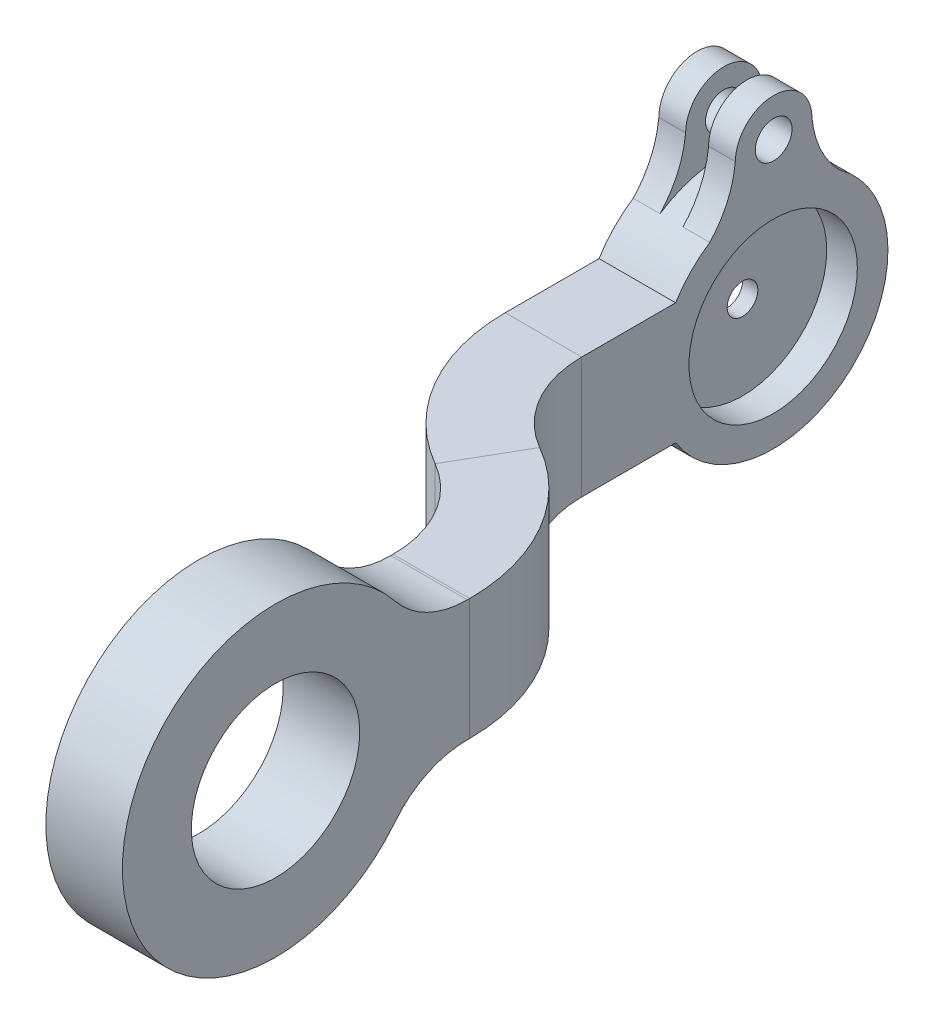
from build123d import *

# Parameters (mm, degrees)
CROQUIS2_W              = 10
CROQUIS2_H              = 15.834903248
CROQUIS4_R              = 15
SALIENTE_EXTRUIR1_DEPTH = 10
CROQUIS5_R              = 20
SALIENTE_EXTRUIR2_DEPTH = 10
SALIENTE_EXTRUIR5_DEPTH = 3.5
CROQUIS13_R             = 2.4
CORTAR_EXTRUIR1_DEPTH   = 10
CROQUIS7_R              = 11
CORTAR_EXTRUIR3_DEPTH   = 10
REDONDEO2_R             = 12
REDONDEO3_R             = 12
CROQUIS14_R             = 11
CORTAR_EXTRUIR4_DEPTH   = 4
CROQUIS6_R              = 2
CORTAR_EXTRUIR5_DEPTH   = 6
CORTAR_EXTRUIR6_START   = -4
CROQUIS15_R             = 11
CORTAR_EXTRUIR6_DEPTH   = 4


with BuildPart() as part:
    # Barrer1: sweep along a path in Croquis1
    with BuildLine(Plane(origin=(0, 0, 0), x_dir=(1, 0, 0), z_dir=(0, 1, 0))) as barrer1_path:
        Line((-20, 85), (-20, 60))
        ThreePointArc((-20, 60), (-17.320508076, 50), (-10, 42.679491924))
        ThreePointArc((-10, 42.679491924), (-2.679491924, 35.358983849), (0, 25.358983849))
        Line((0, 25.358983849), (0, 0))
    # Croquis2 → Barrer1 (sweep)
    with BuildSketch(Plane.XY):
        Rectangle(CROQUIS2_W, CROQUIS2_H)
    sweep(path=barrer1_path.line)

    # Croquis4 → Saliente-Extruir1 (add)
    with BuildSketch(Plane(origin=(-15, 0, 0), x_dir=(0, 0, -1), z_dir=(1, 0, 0))):
        with Locations((85, 0)):
            Circle(CROQUIS4_R)
    extrude(amount=-SALIENTE_EXTRUIR1_DEPTH)

    # Croquis5 → Saliente-Extruir2 (add)
    with BuildSketch(Plane(origin=(5, 0, 0), x_dir=(0, 0, -1), z_dir=(1, 0, 0))):
        Circle(CROQUIS5_R)
    extrude(amount=-SALIENTE_EXTRUIR2_DEPTH)

    # Croquis12 → Saliente-Extruir5 (add)
    with BuildSketch(Plane(origin=(-15, 0, 0), x_dir=(0, 0, -1), z_dir=(1, 0, 0))):
        with BuildLine():
            ThreePointArc((90.068496439, 19.972615481), (85.068496439, 24.972615481), (80.068496439, 19.972615481))
            add(Edge.make_bspline(
                [(80.068496439, 19.972615481), (79.566731031, 15.028252388), (75.848465439, 11.643922813)],
                knots=[0, 0, 0, 1, 1, 1], degree=2))
            ThreePointArc((75.848465439, 11.643922813), (85.068496439, 14.846363713), (94.288527439, 11.643922813))
            add(Edge.make_bspline(
                [(90.068496439, 19.972615481), (90.570261847, 15.028252388), (94.288527439, 11.643922813)],
                knots=[0, 0, 0, 1, 1, 1], degree=2))
        make_face()
    saliente_extruir5 = extrude(amount=-SALIENTE_EXTRUIR5_DEPTH)

    # Simetría1: Saliente-Extruir5 across plane
    add(saliente_extruir5.mirror(Plane(origin=(-20, 0, 0), x_dir=(0, 0, 1), z_dir=(1, 0, 0))))

    # Croquis13 → Cortar-Extruir1 (cut)
    with BuildSketch(Plane(origin=(-15, 0, 0), x_dir=(0, 0, -1), z_dir=(1, 0, 0))):
        with Locations((85.068496439, 19.972615481)):
            Circle(CROQUIS13_R)
    extrude(amount=-CORTAR_EXTRUIR1_DEPTH, mode=Mode.SUBTRACT)

    # Croquis7 → Cortar-Extruir3 (cut)
    with BuildSketch(Plane(origin=(5, 0, 0), x_dir=(0, 0, -1), z_dir=(1, 0, 0))):
        Circle(CROQUIS7_R)
    extrude(amount=-CORTAR_EXTRUIR3_DEPTH, mode=Mode.SUBTRACT)

    # Redondeo2
    redondeo2_edges = [part.edges().sort_by_distance(p)[0] for p in [
        (0, 7.917451624, -18.366108999),
    ]]
    fillet(redondeo2_edges, radius=REDONDEO2_R)

    # Redondeo3
    redondeo3_edges = [part.edges().sort_by_distance(p)[0] for p in [
        (0, -7.917451624, -18.366108999),
    ]]
    fillet(redondeo3_edges, radius=REDONDEO3_R)

    # Croquis14 → Cortar-Extruir4 (cut)
    with BuildSketch(Plane.ZY.offset(25)):
        with Locations((-85, 0)):
            Circle(CROQUIS14_R)
    extrude(amount=-CORTAR_EXTRUIR4_DEPTH, mode=Mode.SUBTRACT)

    # Croquis6 → Cortar-Extruir5 (cut)
    with BuildSketch(Plane(origin=(-15, 0, 0), x_dir=(0, 0, -1), z_dir=(1, 0, 0))):
        with Locations((85, 0)):
            Circle(CROQUIS6_R)
    extrude(amount=-CORTAR_EXTRUIR5_DEPTH, mode=Mode.SUBTRACT)

    # Croquis15 → Cortar-Extruir6 (cut)
    with BuildSketch(Plane(origin=(-15, 0, 0), x_dir=(0, 0, -1), z_dir=(1, 0, 0)).offset(CORTAR_EXTRUIR6_START)):
        with Locations(Location((85, 0, 0), (0, 0, 180))):
            Circle(CROQUIS15_R)
    extrude(amount=CORTAR_EXTRUIR6_DEPTH, mode=Mode.SUBTRACT)


solid = part.part
